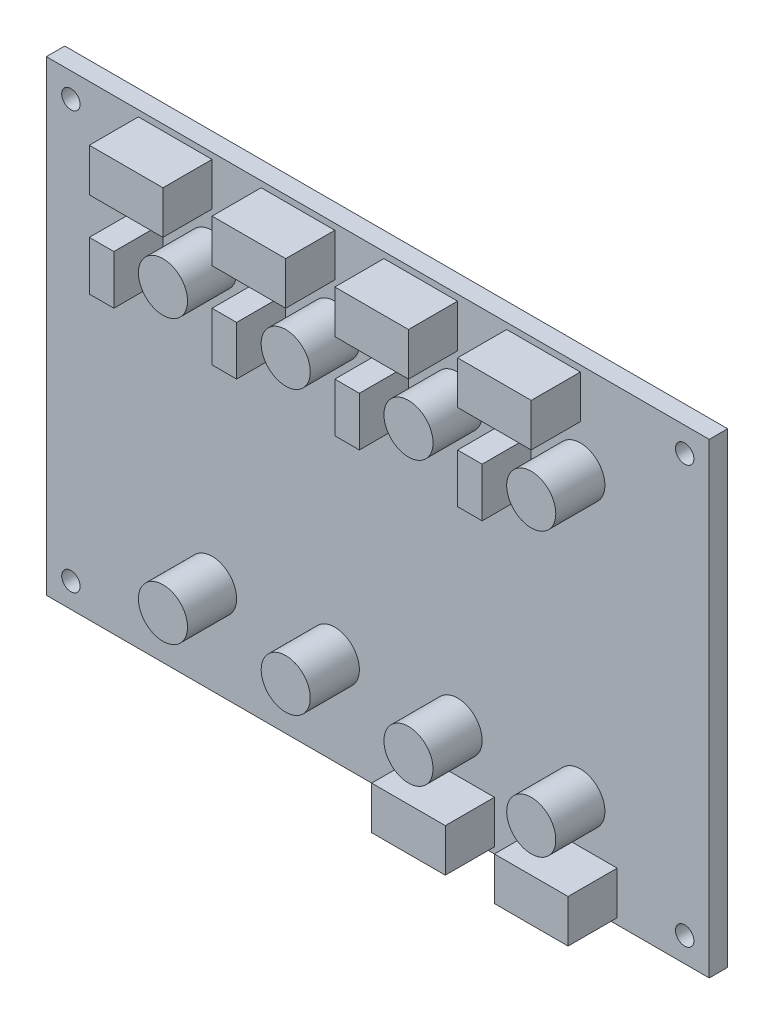
from build123d import *

# Parameters (mm, degrees)
SKETCH_1_W      = 108
SKETCH_1_H      = 76
SKETCH_1_R      = 1.5
EXTRUDE_1_DEPTH = 3
SKETCH_2_R      = 4
SKETCH_2_W      = 12
SKETCH_2_H      = 7
SKETCH_2_W_2    = 4
SKETCH_2_H_2    = 8
EXTRUDE_2_DEPTH = 8


with BuildPart() as part:
    # 草图1 → 凸台-拉伸1 (new body)
    with BuildSketch(Plane.XY):
        Rectangle(SKETCH_1_W, SKETCH_1_H)
        with Locations((-50, 34)):
            Circle(SKETCH_1_R, mode=Mode.SUBTRACT)
        with Locations((50, 34)):
            Circle(SKETCH_1_R, mode=Mode.SUBTRACT)
        with Locations((50, -34)):
            Circle(SKETCH_1_R, mode=Mode.SUBTRACT)
        with Locations((-50, -34)):
            Circle(SKETCH_1_R, mode=Mode.SUBTRACT)
    extrude(amount=EXTRUDE_1_DEPTH)

    # 草图2 → 凸台-拉伸2 (add)
    with BuildSketch(Plane.XY.offset(3)):
        with Locations((-27, 23)):
            Circle(SKETCH_2_R)
        with Locations((-7, 23)):
            Circle(SKETCH_2_R)
        with Locations((13, 23)):
            Circle(SKETCH_2_R)
        with Locations((33, 23)):
            Circle(SKETCH_2_R)
        with Locations(Location((33, -23, 0), (0, 0, 180))):
            Circle(SKETCH_2_R)
        with Locations(Location((13, -23, 0), (0, 0, 180))):
            Circle(SKETCH_2_R)
        with Locations(Location((-7, -23, 0), (0, 0, 180))):
            Circle(SKETCH_2_R)
        with Locations(Location((-27, -23, 0), (0, 0, 180))):
            Circle(SKETCH_2_R)
        with Locations((-33, 33.5)):
            Rectangle(SKETCH_2_W, SKETCH_2_H)
        with Locations((-13, 33.5)):
            Rectangle(SKETCH_2_W, SKETCH_2_H)
        with Locations((7, 33.5)):
            Rectangle(SKETCH_2_W, SKETCH_2_H)
        with Locations((27, 33.5)):
            Rectangle(SKETCH_2_W, SKETCH_2_H)
        with Locations((-37, 20)):
            Rectangle(SKETCH_2_W_2, SKETCH_2_H_2)
        with Locations((-17, 20)):
            Rectangle(SKETCH_2_W_2, SKETCH_2_H_2)
        with Locations((3, 20)):
            Rectangle(SKETCH_2_W_2, SKETCH_2_H_2)
        with Locations((23, 20)):
            Rectangle(SKETCH_2_W_2, SKETCH_2_H_2)
        with Locations((33, -33.5)):
            Rectangle(SKETCH_2_W, SKETCH_2_H)
        with Locations((13, -33.5)):
            Rectangle(SKETCH_2_W, SKETCH_2_H)
    extrude(amount=EXTRUDE_2_DEPTH)


solid = part.part
